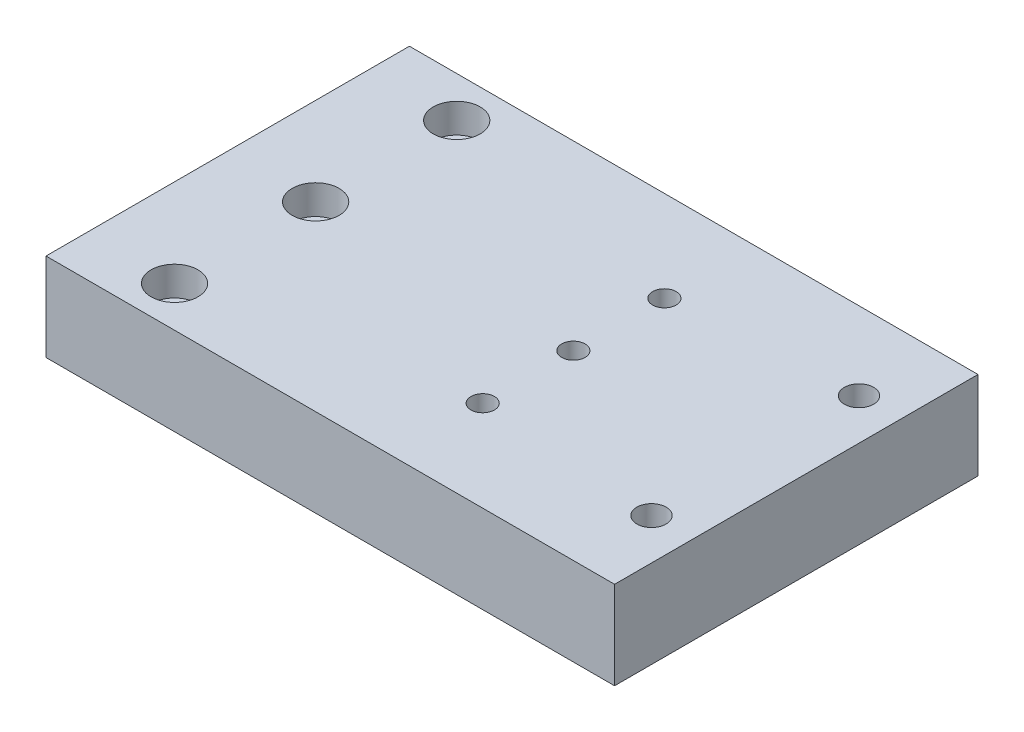
from build123d import *

# Parameters (mm, degrees)
ESBO_O1_W                = 67
ESBO_O1_H                = 62
RESSALTO_EXTRUS_O1_DEPTH = 15
ESBO_O2_R                = 2.5
ESBO_O2_R_2              = 2
CORTE_EXTRUS_O1_DEPTH    = 93.509458976
ESBO_O3_W                = 62
ESBO_O3_H                = 15
RESSALTO_EXTRUS_O2_DEPTH = 30
ESBO_O4_R                = 2.5
CORTE_EXTRUS_O2_DEPTH    = 93.509458976
ESBO_O5_R                = 4
CORTE_EXTRUS_O3_DEPTH    = 5


with BuildPart() as part:
    # Esboço1 → Ressalto-extrusão1 (new body)
    with BuildSketch(Plane(origin=(0, 0, 0), x_dir=(1, 0, 0), z_dir=(0, 1, 0))):
        with Locations((33.5, -31)):
            Rectangle(ESBO_O1_W, ESBO_O1_H)
    extrude(amount=RESSALTO_EXTRUS_O1_DEPTH)

    # Esboço2 → Corte-extrusão1 (cut, through all)
    with BuildSketch(Plane(origin=(0, 15, 0), x_dir=(1, 0, 0), z_dir=(0, 1, 0))):
        with Locations(Location((60, -13.3, 0), (0, 0, 270))):
            Circle(ESBO_O2_R)
        with Locations(Location((60, -48.7, 0), (0, 0, 270))):
            Circle(ESBO_O2_R)
        with Locations(Location((29, -46.5, 0), (0, 0, 270))):
            Circle(ESBO_O2_R_2)
        with Locations(Location((28.970556633, -31, 0), (0, 0, 270))):
            Circle(ESBO_O2_R_2)
        with Locations(Location((29, -15.5, 0), (0, 0, 270))):
            Circle(ESBO_O2_R_2)
    extrude(amount=-CORTE_EXTRUS_O1_DEPTH, mode=Mode.SUBTRACT)

    # Esboço3 → Ressalto-extrusão2 (add)
    with BuildSketch(Plane.ZY):
        with Locations((31, 7.5)):
            Rectangle(ESBO_O3_W, ESBO_O3_H)
    extrude(amount=RESSALTO_EXTRUS_O2_DEPTH)

    # Esboço4 → Corte-extrusão2 (cut, through all)
    with BuildSketch(Plane(origin=(0, 15, 0), x_dir=(1, 0, 0), z_dir=(0, 1, 0))):
        with Locations(Location((-15, -31, 0), (0, 0, 270))):
            Circle(ESBO_O4_R)
        with Locations(Location((-15, -6.93, 0), (0, 0, 270))):
            Circle(ESBO_O4_R)
        with Locations(Location((-15, -55.07, 0), (0, 0, 270))):
            Circle(ESBO_O4_R)
    extrude(amount=-CORTE_EXTRUS_O2_DEPTH, mode=Mode.SUBTRACT)

    # Esboço5 → Corte-extrusão3 (cut)
    with BuildSketch(Plane(origin=(0, 15, 0), x_dir=(1, 0, 0), z_dir=(0, 1, 0))):
        with Locations(Location((-15, -6.93, 0), (0, 0, 270))):
            Circle(ESBO_O5_R)
        with Locations(Location((-15, -31, 0), (0, 0, 270))):
            Circle(ESBO_O5_R)
        with Locations(Location((-15, -55.07, 0), (0, 0, 270))):
            Circle(ESBO_O5_R)
    extrude(amount=-CORTE_EXTRUS_O3_DEPTH, mode=Mode.SUBTRACT)


solid = part.part
